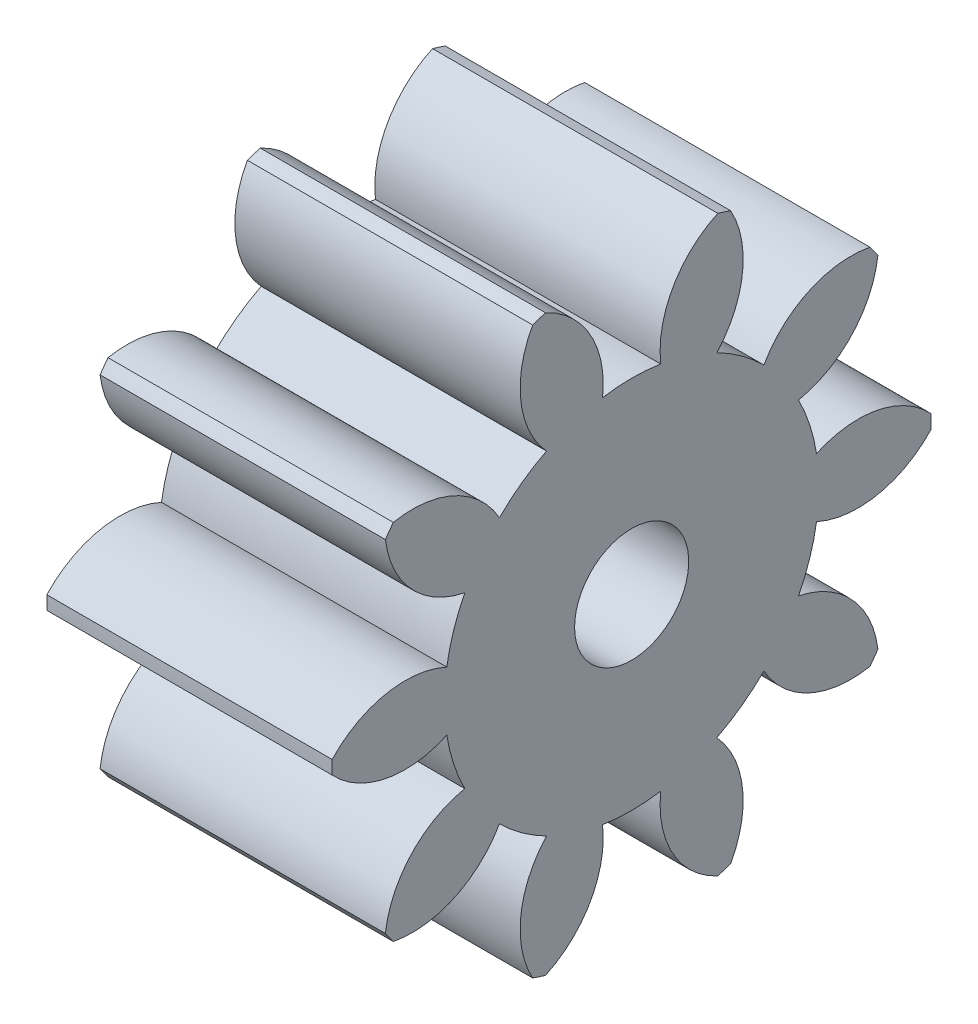
from build123d import *

# Parameters (mm, degrees)
BASPROSKE_W     = 10
BASPROSKE_H     = 10.5
TOOTHCUT_DEPTH  = 18.90251379
TEETHCUTS_COUNT = 10
TEETHCUTS_ANGLE = 324
BORSKE_R        = 2
BORE_DEPTH      = 50.0000508
SCALE1_SCALE    = 0.95


with BuildPart() as part:
    # BasProSke → Base-Revolve (revolve)
    with BuildSketch(Plane(origin=(0, 0, 0), x_dir=(1, 0, 0), z_dir=(0, 1, 0)), mode=Mode.PRIVATE) as base_revolve_sk:
        with Locations((5, 5.25)):
            Rectangle(BASPROSKE_W, BASPROSKE_H)
    revolve(base_revolve_sk.sketch.rotate(Axis((-10, 0, 0), (1, 0, 0)), 180), axis=Axis((-10, 0, 0), (1, 0, 0)))

    # TooCutSke → ToothCut (cut, through all)
    with BuildSketch(Plane(origin=(0, 0, 0), x_dir=(0, 0, -1), z_dir=(1, 0, 0))):
        with BuildLine():
            ThreePointArc((1.019600066, 6.481797432), (0, 6.5615), (-1.019600066, 6.481797432))
            ThreePointArc((-1.019600066, 6.481797432), (-1.451036104, 8.608938557), (-3.053606956, 10.072712133))
            ThreePointArc((-3.053606956, 10.072712133), (0, 10.5254), (3.053606956, 10.072712133))
            ThreePointArc((3.053606956, 10.072712133), (1.451036104, 8.608938557), (1.019600066, 6.481797432))
        make_face()
    toothcut = extrude(amount=TOOTHCUT_DEPTH, mode=Mode.SUBTRACT)

    # TeethCuts: ToothCut ×10 about axis
    teethcuts_axis = Axis((-10, 0, 0), (1, 0, 0))
    for i in range(1, TEETHCUTS_COUNT):
        add(toothcut.rotate(teethcuts_axis, i * TEETHCUTS_ANGLE / (TEETHCUTS_COUNT - 1)), mode=Mode.SUBTRACT)

    # BorSke → Bore (cut, symmetric)
    with BuildSketch(Plane(origin=(0, 0, 0), x_dir=(0, 0, -1), z_dir=(1, 0, 0))):
        with Locations(Location((0, 0, 0), (0, 0, 180))):
            Circle(BORSKE_R)
    extrude(amount=BORE_DEPTH, both=True, mode=Mode.SUBTRACT)


with BuildPart() as part_1:
    # Scale1: scaled about (5, 0, 0)
    add(part.part.scale(SCALE1_SCALE).moved(Location((0.25, 0, 0))))


solid = part_1.part
